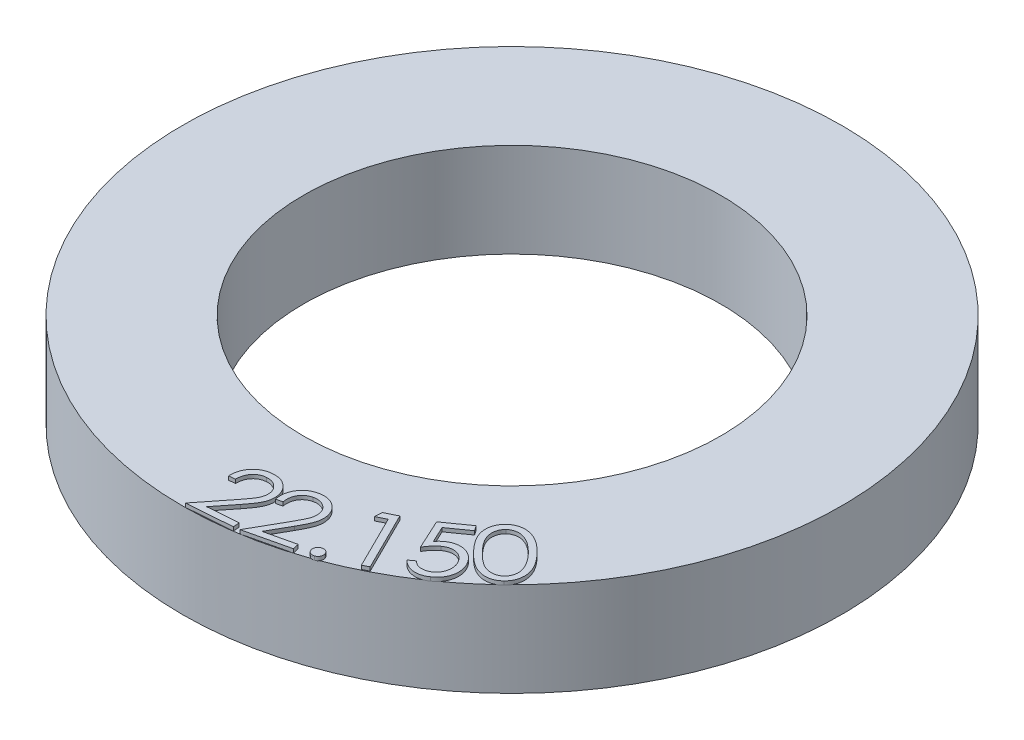
from build123d import *

# Parameters (mm, degrees)
SKETCH1_R           = 17.5
SKETCH1_R_2         = 11.075
BOSS_EXTRUDE1_DEPTH = 5
BOSS_EXTRUDE8_DEPTH = 0.2


with BuildPart() as part:
    # Sketch1 → Boss-Extrude1 (new body)
    with BuildSketch(Plane(origin=(0, 0, 0), x_dir=(1, 0, 0), z_dir=(0, 1, 0))):
        Circle(SKETCH1_R)
        Circle(SKETCH1_R_2, mode=Mode.SUBTRACT)
    extrude(amount=BOSS_EXTRUDE1_DEPTH)

    # Sketch8 → Boss-Extrude8 (add)
    # profile 1 of 6: a face of its own
    with BuildSketch(Plane(origin=(0, 5, 0), x_dir=(1, 0, 0), z_dir=(0, 1, 0))):
        with BuildLine():
            Line((0.377203526, -15.06640625), (0.043469551, -15.092347756))
            add(Edge.make_bspline(
                [(0.043469551, -15.092347756), (0.042203297, -15.050032699), (0.039723419, -14.96716131), (0.049638285, -14.844981972), (0.067688405, -14.727624407), (0.098455755, -14.61556583), (0.138504263, -14.508522308), (0.188279293, -14.405930448), (0.249943807, -14.309195828), (0.320224245, -14.217586795), (0.399116148, -14.133937543), (0.484222111, -14.059456033), (0.574336923, -13.993992114), (0.671078969, -13.940092371), (0.773224869, -13.895612995), (0.881084602, -13.861423192), (0.994390789, -13.836174987), (1.072362547, -13.828578994), (1.111979167, -13.824719551)],
                knots=[0, 0, 0, 0, 1.099165856, 2.152647473, 3.179901334, 4.180092559, 5.165857059, 6.14623908, 7.136854445, 8.141313093, 9.142222958, 10.119044223, 11.076246807, 12.030555843, 12.990566437, 13.966122304, 14.966608418, 16, 16, 16, 16], degree=3))
            add(Edge.make_bspline(
                [(1.111979167, -13.824719551), (1.151232363, -13.822614291), (1.227892409, -13.818502795), (1.341072803, -13.824300473), (1.449209712, -13.840047194), (1.552456645, -13.867170925), (1.650809554, -13.903432336), (1.744251767, -13.950064736), (1.832189716, -14.007297288), (1.914237577, -14.07371881), (1.989801801, -14.146775331), (2.056191283, -14.225750107), (2.115236363, -14.307662186), (2.163673815, -14.394967734), (2.203994369, -14.485852699), (2.23381166, -14.581483532), (2.256306856, -14.680631266), (2.263224051, -14.74868976), (2.266726763, -14.783153045)],
                knots=[0, 0, 0, 0, 1.125255338, 2.197582177, 3.23984224, 4.249678898, 5.249348258, 6.237204937, 7.234226399, 8.248247252, 9.256507582, 10.239567543, 11.199778339, 12.143800945, 13.093950023, 14.042329097, 15.008679649, 16, 16, 16, 16], degree=3))
            add(Edge.make_bspline(
                [(2.266726763, -14.783153045), (2.268653871, -14.83201524), (2.272472697, -14.928842275), (2.256591946, -15.073272294), (2.221554197, -15.213909987), (2.177756368, -15.329043673), (2.13210079, -15.422970742), (2.088829613, -15.499650514), (2.039151976, -15.583479859), (1.980752569, -15.67318269), (1.913642882, -15.76882397), (1.840613729, -15.872212721), (1.757921696, -15.980725817), (1.700055339, -16.055042687), (1.670072115, -16.093549679)],
                knots=[0, 0, 0, 0, 1.190284496, 2.358709392, 3.525773572, 4.713480732, 5.352743619, 6.06901355, 6.858115264, 7.726847504, 8.676217017, 9.704931629, 10.810819393, 12, 12, 12, 12], degree=3))
            Line((1.670072115, -16.093549679), (0.875701122, -17.094751603))
            Line((0.875701122, -17.094751603), (2.482672276, -16.971354167))
            Line((2.482672276, -16.971354167), (2.508613782, -17.307191506))
            Line((2.508613782, -17.307191506), (0.14443109, -17.488782051))
            Line((0.14443109, -17.488782051), (1.363681891, -15.949819712))
            add(Edge.make_bspline(
                [(1.363681891, -15.949819712), (1.393527022, -15.912554926), (1.450782044, -15.841066007), (1.530584566, -15.73612355), (1.602999147, -15.639675593), (1.666852925, -15.550639363), (1.722438282, -15.469396851), (1.76961629, -15.395481899), (1.809021619, -15.329602995), (1.849329165, -15.251857602), (1.888211722, -15.159145837), (1.917541309, -15.046099013), (1.933704742, -14.93175562), (1.93042781, -14.855174346), (1.928786058, -14.816806891)],
                knots=[0, 0, 0, 0, 1.323859622, 2.539697786, 3.655679983, 4.668207506, 5.577749991, 6.384956845, 7.099630202, 7.705429782, 8.812646299, 9.878423536, 10.93708365, 12, 12, 12, 12], degree=3))
            add(Edge.make_bspline(
                [(1.928786058, -14.816806891), (1.92620974, -14.792668697), (1.921140936, -14.745177743), (1.905685163, -14.675960851), (1.882668381, -14.610204079), (1.854314913, -14.54686504), (1.818130268, -14.487171166), (1.775716227, -14.430480301), (1.726271651, -14.377301953), (1.671340099, -14.327125852), (1.611934069, -14.281949704), (1.548780398, -14.24375581), (1.483443961, -14.212316408), (1.415907726, -14.186368957), (1.345139571, -14.169292508), (1.271999298, -14.157876025), (1.196114655, -14.153502913), (1.144924611, -14.156323447), (1.118990385, -14.157752404)],
                knots=[0, 0, 0, 0, 1.002985613, 1.973335034, 2.923515741, 3.878986154, 4.836651989, 5.802759845, 6.800988188, 7.833639541, 8.87511098, 9.880838076, 10.878972912, 11.86950441, 12.865345595, 13.881918786, 14.926924211, 16, 16, 16, 16], degree=3))
            add(Edge.make_bspline(
                [(1.118990385, -14.157752404), (1.091811261, -14.160540619), (1.038491161, -14.166010548), (0.960749235, -14.182373159), (0.886899306, -14.205342141), (0.817246391, -14.235736869), (0.751710741, -14.272344942), (0.690146343, -14.315288584), (0.633132276, -14.365692478), (0.580060436, -14.422065975), (0.532383632, -14.484564259), (0.490634628, -14.552362028), (0.455698611, -14.625546395), (0.426899376, -14.703718722), (0.404472482, -14.787020099), (0.388336351, -14.875402791), (0.379467781, -14.969236984), (0.377971809, -15.033435801), (0.377203526, -15.06640625)],
                knots=[0, 0, 0, 0, 1.003856858, 1.969369873, 2.914991585, 3.842326504, 4.757764574, 5.67065914, 6.596081697, 7.550367434, 8.512664105, 9.480773, 10.472199548, 11.488843046, 12.539268398, 13.639696742, 14.787824085, 16, 16, 16, 16], degree=3))
        make_face()
    # profile 2 of 6: a face of its own
    with BuildSketch(Plane(origin=(0, 5, 0), x_dir=(1, 0, 0), z_dir=(0, 1, 0))):
        with BuildLine():
            Line((2.680077799, -14.84254585), (2.355458408, -14.918267004))
            add(Edge.make_bspline(
                [(2.355458408, -14.918267004), (2.347994142, -14.876767046), (2.333387531, -14.795556953), (2.323472579, -14.673990721), (2.324976016, -14.555728299), (2.336513827, -14.440605451), (2.359783356, -14.328975701), (2.394590343, -14.221092867), (2.439601661, -14.116379831), (2.494569659, -14.015576781), (2.559832485, -13.921863348), (2.631188548, -13.834656401), (2.710921768, -13.757361702), (2.797573287, -13.688946733), (2.891342116, -13.629703088), (2.992353062, -13.580084855), (3.099856127, -13.537971321), (3.175300136, -13.518303724), (3.213631485, -13.508311075)],
                knots=[0, 0, 0, 0, 1.100238416, 2.153025381, 3.178012026, 4.183884262, 5.168591255, 6.148695239, 7.138002634, 8.140019377, 9.140121407, 10.114951831, 11.077023251, 12.032670763, 12.99234068, 13.966349905, 14.966749606, 16, 16, 16, 16], degree=3))
            add(Edge.make_bspline(
                [(3.213631485, -13.508311075), (3.251843088, -13.50036415), (3.32664053, -13.484808413), (3.438897548, -13.473770246), (3.547813259, -13.472847982), (3.653615731, -13.482442125), (3.755983303, -13.503477882), (3.854414489, -13.536291351), (3.950096274, -13.578421826), (4.040814221, -13.631584861), (4.126003653, -13.692404589), (4.204208412, -13.758970295), (4.274030899, -13.831494589), (4.335160407, -13.90960072), (4.388361962, -13.993145467), (4.432982751, -14.082231672), (4.470178835, -14.176708828), (4.487307474, -14.242643219), (4.495983248, -14.27603944)],
                knots=[0, 0, 0, 0, 1.121990491, 2.196244399, 3.238232453, 4.250969426, 5.246356061, 6.236987075, 7.230101134, 8.248200839, 9.255501669, 10.237657177, 11.19803806, 12.146105858, 13.086011545, 14.042029985, 15.008274769, 16, 16, 16, 16], degree=3))
            add(Edge.make_bspline(
                [(4.495983248, -14.27603944), (4.505415824, -14.323774993), (4.524110077, -14.41838123), (4.529985585, -14.56283772), (4.516844757, -14.706380405), (4.49162199, -14.826395359), (4.460506924, -14.925374116), (4.431085731, -15.007919873), (4.393488718, -15.097141834), (4.349829317, -15.194418504), (4.299347185, -15.299042154), (4.242538162, -15.411720311), (4.177915647, -15.531101044), (4.131979942, -15.612908193), (4.108262895, -15.655146011)],
                knots=[0, 0, 0, 0, 1.190223456, 2.358882579, 3.52524119, 4.712819824, 5.35365978, 6.065105631, 6.857984567, 7.723828008, 8.67607557, 9.702436758, 10.813745988, 12, 12, 12, 12], degree=3))
            Line((4.108262895, -15.655146011), (3.479356645, -16.761516203))
            Line((3.479356645, -16.761516203), (5.041456004, -16.394829504))
            Line((5.041456004, -16.394829504), (5.11787828, -16.721552261))
            Line((5.11787828, -16.721552261), (2.819601036, -17.260714921))
            Line((2.819601036, -17.260714921), (3.785045748, -15.56119569))
            add(Edge.make_bspline(
                [(3.785045748, -15.56119569), (3.808529371, -15.519892567), (3.8536226, -15.440582352), (3.91665988, -15.325551236), (3.973290102, -15.219474376), (4.021957514, -15.121779814), (4.064311127, -15.032979861), (4.100364837, -14.953571722), (4.128654637, -14.882434307), (4.156784414, -14.800101176), (4.179688984, -14.702577351), (4.192972915, -14.587024863), (4.189968714, -14.471889792), (4.175230987, -14.396958355), (4.167858248, -14.359472934)],
                knots=[0, 0, 0, 0, 1.322508168, 2.539478858, 3.65113322, 4.669382137, 5.577246142, 6.389686428, 7.096378664, 7.707362647, 8.810322298, 9.877140803, 10.938012216, 12, 12, 12, 12], degree=3))
            add(Edge.make_bspline(
                [(4.167858248, -14.359472934), (4.161829404, -14.336171476), (4.149935411, -14.290201239), (4.123387221, -14.224893717), (4.091995869, -14.16328915), (4.053584185, -14.106135055), (4.009399893, -14.052600205), (3.95860095, -14.003544562), (3.901957352, -13.958350343), (3.840235373, -13.917568468), (3.775029978, -13.881814057), (3.707248163, -13.853637752), (3.637912338, -13.832678602), (3.56741324, -13.817301491), (3.494890393, -13.811664684), (3.421495235, -13.811468351), (3.346244991, -13.818247864), (3.296509601, -13.82889709), (3.271123472, -13.834332709)],
                knots=[0, 0, 0, 0, 0.998805992, 1.97049261, 2.921394182, 3.866479787, 4.824835265, 5.799717433, 6.794315519, 7.830951375, 8.869177059, 9.878822869, 10.873799922, 11.875291578, 12.869368348, 13.888722291, 14.922353531, 16, 16, 16, 16], degree=3))
            add(Edge.make_bspline(
                [(3.271123472, -13.834332709), (3.244792519, -13.841064204), (3.193002937, -13.854304184), (3.119061623, -13.882705923), (3.050115946, -13.91714881), (2.986034959, -13.957311139), (2.926579811, -14.002814596), (2.87305675, -14.05555418), (2.823928987, -14.113545846), (2.780414933, -14.177443519), (2.743380272, -14.246402199), (2.712244756, -14.319205359), (2.689061885, -14.396615139), (2.673136557, -14.477873433), (2.664009273, -14.563501926), (2.662180891, -14.653056839), (2.666949138, -14.746824786), (2.675629023, -14.810109822), (2.680077799, -14.84254585)],
                knots=[0, 0, 0, 0, 1.001857296, 1.97052376, 2.915105733, 3.840812044, 4.756468097, 5.670946457, 6.606992161, 7.556283339, 8.516782409, 9.490308786, 10.47212129, 11.491627338, 12.540773751, 13.644567144, 14.792749573, 16, 16, 16, 16], degree=3))
        make_face()
    # profile 3 of 6: a face of its own
    with BuildSketch(Plane(origin=(0, 5, 0), x_dir=(1, 0, 0), z_dir=(0, 1, 0))):
        with BuildLine():
            add(Edge.make_bspline(
                [(5.812610444, -15.938128556), (5.831374417, -15.932374898), (5.868100028, -15.921113607), (5.925587729, -15.918820778), (5.982023209, -15.927326543), (6.036365652, -15.947186897), (6.086750753, -15.976062519), (6.129683552, -16.014781695), (6.164195697, -16.061839206), (6.179302393, -16.097844445), (6.187009483, -16.116213491)],
                knots=[0, 0, 0, 0, 1.018533362, 1.993514881, 2.966138152, 3.9748784, 4.989476654, 5.972026843, 6.965374611, 8, 8, 8, 8], degree=3))
            add(Edge.make_bspline(
                [(6.187009483, -16.116213491), (6.192680674, -16.134982532), (6.203852009, -16.171954526), (6.207259114, -16.229869607), (6.198423544, -16.286997519), (6.178873974, -16.341926891), (6.149719297, -16.392227049), (6.111823907, -16.435344643), (6.065578658, -16.469979456), (6.029886494, -16.484584723), (6.011729034, -16.492014773)],
                knots=[0, 0, 0, 0, 1.018247088, 2.005783202, 2.990165439, 4.010083513, 5.024396598, 5.998572224, 6.981825626, 8, 8, 8, 8], degree=3))
            add(Edge.make_bspline(
                [(6.011729034, -16.492014773), (5.992964701, -16.497770106), (5.956238387, -16.509034678), (5.898755786, -16.511303732), (5.842003107, -16.502843983), (5.787364663, -16.482393394), (5.737095106, -16.452595757), (5.694096527, -16.414271405), (5.660232144, -16.367416245), (5.645083379, -16.332037335), (5.637329996, -16.313929838)],
                knots=[0, 0, 0, 0, 1.019327242, 1.995068695, 2.968450063, 3.99358383, 5.015165017, 5.99848104, 6.975590248, 8, 8, 8, 8], degree=3))
            add(Edge.make_bspline(
                [(5.637329996, -16.313929838), (5.63125142, -16.294941947), (5.619366426, -16.257816312), (5.617673921, -16.1996281), (5.624612676, -16.142442807), (5.645777227, -16.087974496), (5.675371175, -16.038150206), (5.712952105, -15.994657098), (5.759716127, -15.961248414), (5.794765915, -15.945928316), (5.812610444, -15.938128556)],
                knots=[0, 0, 0, 0, 1.033330105, 2.02039479, 3.003248301, 4.016090021, 5.036799157, 6.01117572, 6.98745084, 8, 8, 8, 8], degree=3))
        make_face()
    # profile 4 of 6: a face of its own
    with BuildSketch(Plane(origin=(0, 5, 0), x_dir=(1, 0, 0), z_dir=(0, 1, 0))):
        Polygon((5.818273577, -12.696277718), (6.43245627, -12.391289737), (7.984038802, -15.51759182), (7.673441847, -15.671838615), (6.274002744, -12.851926756), (5.783217488, -13.095216019), align=None)
    # profile 5 of 6: a face of its own
    with BuildSketch(Plane(origin=(0, 5, 0), x_dir=(1, 0, 0), z_dir=(0, 1, 0))):
        with BuildLine():
            Line((8.905820544, -10.81501346), (9.096525672, -11.084945351))
            Line((9.096525672, -11.084945351), (8.086209166, -11.800089582))
            Line((8.086209166, -11.800089582), (8.492859807, -12.672285095))
            add(Edge.make_bspline(
                [(8.492859807, -12.672285095), (8.51705623, -12.642776), (8.563899554, -12.58564755), (8.637538854, -12.507497305), (8.711727906, -12.439832324), (8.763205185, -12.400830704), (8.788032083, -12.382020672)],
                knots=[0, 0, 0, 0, 1.102510947, 2.134417912, 3.100251258, 4, 4, 4, 4], degree=3))
            add(Edge.make_bspline(
                [(8.788032083, -12.382020672), (8.820109592, -12.360315139), (8.883205401, -12.317620797), (8.983169841, -12.26619245), (9.084104752, -12.224617519), (9.186966618, -12.195460631), (9.291137291, -12.175799501), (9.397000003, -12.169368235), (9.504117602, -12.17260687), (9.611627853, -12.187634211), (9.717726072, -12.212338375), (9.819983806, -12.248599798), (9.917768605, -12.294202417), (10.010991446, -12.349865714), (10.099073358, -12.41645699), (10.182463758, -12.493131992), (10.261523131, -12.579753693), (10.309056949, -12.643349646), (10.333304519, -12.675790704)],
                knots=[0, 0, 0, 0, 1.053566777, 2.072344485, 3.054154547, 4.020735706, 4.977911009, 5.934388254, 6.901994919, 7.890871114, 8.884708514, 9.862655974, 10.838946315, 11.817700602, 12.812779523, 13.839512687, 14.897909552, 16, 16, 16, 16], degree=3))
            add(Edge.make_bspline(
                [(10.333304519, -12.675790704), (10.349205912, -12.699235475), (10.380632976, -12.745571055), (10.423192032, -12.817357695), (10.459224738, -12.891028059), (10.491272613, -12.965765182), (10.517783682, -13.042191306), (10.539530664, -13.120165711), (10.556617195, -13.199483347), (10.567516839, -13.279906402), (10.573828031, -13.360199115), (10.575483147, -13.439359499), (10.571252868, -13.517165799), (10.561309826, -13.593496762), (10.546565491, -13.668675023), (10.527043258, -13.742588506), (10.501668394, -13.814991678), (10.470823211, -13.885694753), (10.434827501, -13.954330198), (10.394959037, -14.021481751), (10.349312851, -14.085808807), (10.298517314, -14.147707169), (10.243212212, -14.207138609), (10.183172699, -14.264412663), (10.117967443, -14.319086296), (10.07151531, -14.353130068), (10.047947948, -14.370402082)],
                knots=[0, 0, 0, 0, 1.058904501, 2.092788817, 3.116471482, 4.122554999, 5.131063365, 6.137943179, 7.147208115, 8.161602767, 9.169391864, 10.156790113, 11.119252309, 12.079372117, 13.032029688, 13.98143675, 14.934695052, 15.8971969, 16.862391289, 17.830310157, 18.8144563, 19.807827508, 20.821657655, 21.847463179, 22.90791634, 24, 24, 24, 24], degree=3))
            add(Edge.make_bspline(
                [(10.047947948, -14.370402082), (10.019295417, -14.389862779), (9.9629447, -14.428135985), (9.874220463, -14.475514725), (9.784619171, -14.514890612), (9.693300776, -14.543872575), (9.600833617, -14.565819682), (9.506736536, -14.576358654), (9.411483019, -14.579568571), (9.315757613, -14.572902652), (9.220893158, -14.558560064), (9.128752094, -14.535160072), (9.039718529, -14.504233334), (8.953938577, -14.464936554), (8.871663046, -14.416729616), (8.792363016, -14.361250194), (8.715925142, -14.298110264), (8.669349113, -14.25026174), (8.645704358, -14.225970992)],
                knots=[0, 0, 0, 0, 1.073683973, 2.111606131, 3.114875596, 4.105229039, 5.079452871, 6.057740752, 7.036807216, 8.032083212, 9.029653356, 10.008961322, 10.976446223, 11.949563641, 12.930560464, 13.930051518, 14.949171403, 16, 16, 16, 16], degree=3))
            Line((8.645704358, -14.225970992), (8.937371025, -14.019140063))
            add(Edge.make_bspline(
                [(8.937371025, -14.019140063), (8.961635196, -14.041499254), (9.008383198, -14.084577071), (9.084201285, -14.136832231), (9.158803392, -14.179407726), (9.235041453, -14.209553815), (9.313100915, -14.227387514), (9.393294113, -14.236939881), (9.476366447, -14.235735942), (9.561361266, -14.22584273), (9.646348642, -14.207698302), (9.727651661, -14.178066609), (9.806271974, -14.142161027), (9.854122513, -14.110262042), (9.878276474, -14.094160095)],
                knots=[0, 0, 0, 0, 1.151762453, 2.219016371, 3.209870592, 4.148730593, 5.071934365, 6.000972824, 6.96479679, 7.967796459, 8.988367636, 9.993261107, 10.987039746, 12, 12, 12, 12], degree=3))
            add(Edge.make_bspline(
                [(9.878276474, -14.094160095), (9.900886283, -14.077356933), (9.945405903, -14.044270835), (10.004473384, -13.986657554), (10.056761909, -13.924757469), (10.101869674, -13.857739049), (10.139855962, -13.785798618), (10.170813452, -13.70926527), (10.193994743, -13.627662559), (10.20968222, -13.542453), (10.218603156, -13.455173936), (10.217315446, -13.367835639), (10.20950095, -13.281560177), (10.191643449, -13.196474173), (10.164432518, -13.112986445), (10.130312958, -13.029818023), (10.086624929, -12.948209386), (10.051682837, -12.896353989), (10.033925512, -12.870001441)],
                knots=[0, 0, 0, 0, 0.982901861, 1.935373165, 2.873857243, 3.808820726, 4.750847603, 5.710288131, 6.686831843, 7.708192972, 8.733167937, 9.745322852, 10.754049183, 11.754552243, 12.77418333, 13.817071584, 14.890651141, 16, 16, 16, 16], degree=3))
            add(Edge.make_bspline(
                [(10.033925512, -12.870001441), (10.016739606, -12.847064194), (9.983082244, -12.802143243), (9.927637085, -12.740434092), (9.86765414, -12.687621005), (9.80579606, -12.640216037), (9.739646488, -12.601869214), (9.670297945, -12.570688083), (9.597665974, -12.546894842), (9.522347996, -12.5298286), (9.445441033, -12.521871147), (9.368323581, -12.520522825), (9.291542529, -12.52961606), (9.214665448, -12.545586206), (9.137880173, -12.5704209), (9.061599494, -12.60370084), (8.984937331, -12.64432096), (8.936360282, -12.677627418), (8.911429519, -12.694720992)],
                knots=[0, 0, 0, 0, 1.074776657, 2.104872872, 3.104341879, 4.068556333, 5.023200681, 5.964838422, 6.915611592, 7.885388104, 8.855323063, 9.81081214, 10.772033681, 11.748521529, 12.752018427, 13.792504925, 14.867067091, 16, 16, 16, 16], degree=3))
            add(Edge.make_bspline(
                [(8.911429519, -12.694720992), (8.890466825, -12.710638616), (8.8473348, -12.7433901), (8.783963328, -12.798012343), (8.722079492, -12.860916409), (8.659124859, -12.929738637), (8.597107702, -13.006394604), (8.534604702, -13.08968846), (8.472995615, -13.18061774), (8.432856237, -13.24405509), (8.412230801, -13.276652082)],
                knots=[0, 0, 0, 0, 0.818651868, 1.684426275, 2.599403717, 3.561756698, 4.584719662, 5.664970434, 6.800155744, 8, 8, 8, 8], degree=3))
            Line((8.412230801, -13.276652082), (7.678156281, -11.683703364))
            Line((7.678156281, -11.683703364), (8.905820544, -10.81501346))
        make_face()
    # profile 6 of 6: a face of its own
    with BuildSketch(Plane(origin=(0, 5, 0), x_dir=(1, 0, 0), z_dir=(0, 1, 0))):
        with BuildLine():
            add(Edge.make_bspline(
                [(10.061528562, -12.10955222), (10.022956902, -12.068877282), (9.948043998, -11.989879446), (9.843004253, -11.871191764), (9.746856726, -11.757152028), (9.662558794, -11.645801129), (9.587265593, -11.538869256), (9.523014434, -11.435213056), (9.467760847, -11.335853691), (9.423120937, -11.239404772), (9.387161115, -11.145589547), (9.358439609, -11.053481538), (9.335685504, -10.96320001), (9.320265408, -10.874124207), (9.310912512, -10.786766665), (9.308712669, -10.700467974), (9.313761542, -10.61585785), (9.324855221, -10.532846238), (9.342571358, -10.452301381), (9.365447521, -10.37404815), (9.395206402, -10.299293261), (9.429624987, -10.226848525), (9.470387016, -10.157948288), (9.51591285, -10.091366706), (9.568349735, -10.028763459), (9.606703214, -9.989578446), (9.626131928, -9.969728502)],
                knots=[0, 0, 0, 0, 1.643143098, 3.191270976, 4.645664262, 6.014553529, 7.284140096, 8.478046464, 9.588014013, 10.61488382, 11.590779053, 12.531207317, 13.441789177, 14.318091217, 15.179101305, 16.015191765, 16.845564482, 17.661395641, 18.467677819, 19.261049258, 20.048571613, 20.823839802, 21.609930406, 22.392909899, 23.185896688, 24, 24, 24, 24], degree=3))
            add(Edge.make_bspline(
                [(9.626131928, -9.969728502), (9.646645091, -9.95069727), (9.687318886, -9.912961868), (9.752951978, -9.86262558), (9.82097751, -9.817156486), (9.892700351, -9.779015734), (9.966623737, -9.745702257), (10.043514762, -9.718255129), (10.123183777, -9.696568041), (10.20571016, -9.68103803), (10.290338148, -9.672191802), (10.376851129, -9.668875627), (10.464943764, -9.674490451), (10.554730722, -9.68541183), (10.646285721, -9.703999117), (10.739509478, -9.729242319), (10.834274843, -9.761744286), (10.930937146, -9.801087051), (11.029460742, -9.849217028), (11.13026139, -9.90588491), (11.233052994, -9.972445027), (11.338150651, -10.048209415), (11.4454711, -10.133940855), (11.554567784, -10.229792228), (11.66690382, -10.33373637), (11.740312315, -10.408325038), (11.777874716, -10.446491322)],
                knots=[0, 0, 0, 0, 0.814307392, 1.614620432, 2.405388273, 3.193927934, 3.97672154, 4.764468093, 5.568360162, 6.378448907, 7.206542137, 8.043948668, 8.895854568, 9.773619782, 10.675734413, 11.613311544, 12.583794371, 13.590896081, 14.649966002, 15.774206342, 16.955777189, 18.213503254, 19.545065278, 20.953335129, 22.441051684, 24, 24, 24, 24], degree=3))
            add(Edge.make_bspline(
                [(11.777874716, -10.446491322), (11.814854184, -10.485255248), (11.887044241, -10.560928863), (11.987574534, -10.675759496), (12.079295527, -10.787542626), (12.161694512, -10.896673681), (12.23353433, -11.004058588), (12.297534335, -11.10782118), (12.35070381, -11.20969791), (12.395436672, -11.308899574), (12.430866619, -11.406229864), (12.460879856, -11.501034296), (12.483379386, -11.594506766), (12.498899769, -11.686339274), (12.507460043, -11.776558786), (12.508968567, -11.865183233), (12.503213493, -11.952124966), (12.491394927, -12.037228558), (12.473097417, -12.119669422), (12.449411404, -12.199534266), (12.418928204, -12.275666565), (12.384035539, -12.349408099), (12.342167974, -12.419239764), (12.296135004, -12.487072917), (12.243421183, -12.551026654), (12.204245084, -12.590356211), (12.184525357, -12.610153181)],
                knots=[0, 0, 0, 0, 1.560920867, 3.047176545, 4.445805626, 5.773746473, 7.029772118, 8.209369219, 9.324227381, 10.375918751, 11.377815375, 12.340623291, 13.272194005, 14.176790602, 15.052286813, 15.910448986, 16.756638747, 17.588735874, 18.411585632, 19.215188949, 20.013145761, 20.798980117, 21.589668162, 22.383020387, 23.186075276, 24, 24, 24, 24], degree=3))
            add(Edge.make_bspline(
                [(12.184525357, -12.610153181), (12.16424862, -12.628954402), (12.124046156, -12.666231375), (12.059224592, -12.715701109), (11.992305933, -12.76050639), (11.922365456, -12.798903796), (11.849611869, -12.831325824), (11.774360209, -12.858062908), (11.696280994, -12.878994313), (11.615756722, -12.894783135), (11.532904199, -12.902798821), (11.448531042, -12.905134253), (11.36269871, -12.900118518), (11.275611133, -12.887862414), (11.186983445, -12.869740367), (11.096865638, -12.844171226), (11.005431965, -12.811821524), (10.911644662, -12.773094239), (10.81603972, -12.725093808), (10.717752152, -12.667036278), (10.615902013, -12.59978748), (10.511364422, -12.521162265), (10.402950549, -12.433133181), (10.291585958, -12.334444112), (10.176237024, -12.226733802), (10.100490943, -12.149354631), (10.061528562, -12.10955222)],
                knots=[0, 0, 0, 0, 0.811064481, 1.60808856, 2.389888403, 3.172620267, 3.946285432, 4.725040954, 5.513640096, 6.316661342, 7.130129069, 7.953396753, 8.791500303, 9.649899588, 10.53226685, 11.444204777, 12.396439187, 13.377193406, 14.420034322, 15.532790691, 16.725465982, 17.999767269, 19.369752981, 20.822718841, 22.365665447, 24, 24, 24, 24], degree=3))
        make_face()
        with BuildLine():
            add(Edge.make_bspline(
                [(10.304116703, -11.884492124), (10.337578269, -11.918574154), (10.402540546, -11.984741), (10.500104054, -12.077699958), (10.593067011, -12.162957402), (10.682719911, -12.238661617), (10.768464434, -12.305349323), (10.849584809, -12.364159763), (10.927584923, -12.413096761), (11.001701443, -12.454772772), (11.07418007, -12.487466292), (11.144334876, -12.516073575), (11.213934525, -12.538566035), (11.282589858, -12.555420101), (11.350311854, -12.566903194), (11.41715019, -12.572295009), (11.483263045, -12.573321261), (11.568750426, -12.566641613), (11.670517579, -12.54720082), (11.783580906, -12.506905605), (11.886149609, -12.450915311), (11.943927533, -12.400472609), (11.972786575, -12.37527738)],
                knots=[0, 0, 0, 0, 1.473957898, 2.861541556, 4.158429599, 5.366384119, 6.48165494, 7.510449078, 8.456966946, 9.322163817, 10.132208232, 10.909042953, 11.659478826, 12.387214262, 13.089187375, 13.776821919, 14.454856839, 15.127538109, 16.420448759, 17.638738311, 18.820591935, 20, 20, 20, 20], degree=3))
            add(Edge.make_bspline(
                [(11.972786575, -12.37527738), (11.999096913, -12.347144569), (12.051476146, -12.291137113), (12.111356623, -12.191364249), (12.15518686, -12.081272391), (12.177418612, -11.982136745), (12.186980934, -11.898714603), (12.188238906, -11.833712734), (12.183968496, -11.767351683), (12.174006317, -11.699854924), (12.158528791, -11.630950783), (12.137058338, -11.560904501), (12.111550388, -11.488878351), (12.089791002, -11.44169194), (12.078655966, -11.417545008)],
                knots=[0, 0, 0, 0, 1.340944698, 2.669583919, 4.030928969, 5.461188359, 6.19962706, 6.958188698, 7.726289627, 8.517420774, 9.336470106, 10.187844869, 11.072657056, 12, 12, 12, 12], degree=3))
            add(Edge.make_bspline(
                [(12.078655966, -11.417545008), (12.063987821, -11.387250039), (12.034271656, -11.325875523), (11.983464173, -11.23492443), (11.925602706, -11.144183163), (11.862651218, -11.051783909), (11.792167981, -10.959745433), (11.716675467, -10.866265116), (11.634371449, -10.772887308), (11.576158741, -10.711789779), (11.546504524, -10.680666002)],
                knots=[0, 0, 0, 0, 0.884558049, 1.79202434, 2.736150632, 3.71244019, 4.72966929, 5.78206634, 6.87015931, 8, 8, 8, 8], degree=3))
            add(Edge.make_bspline(
                [(11.546504524, -10.680666002), (11.516301384, -10.650102624), (11.457161501, -10.590257369), (11.367546578, -10.505677176), (11.279867397, -10.427540032), (11.193607132, -10.35629109), (11.10797441, -10.292846712), (11.024755152, -10.235143983), (10.943159202, -10.184037211), (10.862523381, -10.140895389), (10.783992203, -10.103457249), (10.707158132, -10.072406083), (10.632416474, -10.047329921), (10.559769283, -10.027135588), (10.488709433, -10.013658365), (10.419504972, -10.006866602), (10.352163725, -10.004956096), (10.266745298, -10.012015905), (10.165243051, -10.030256677), (10.053220513, -10.071098865), (9.951222655, -10.125903849), (9.89428322, -10.176093731), (9.865915582, -10.201098694)],
                knots=[0, 0, 0, 0, 1.326591129, 2.597559181, 3.803812624, 4.952220953, 6.050454968, 7.093242857, 8.07839134, 9.021111463, 9.915189371, 10.763364664, 11.577972641, 12.348162485, 13.089731918, 13.807721709, 14.493365527, 15.166324271, 16.451327591, 17.663329693, 18.835853919, 20, 20, 20, 20], degree=3))
            add(Edge.make_bspline(
                [(9.865915582, -10.201098694), (9.839602185, -10.229223864), (9.787080212, -10.285362167), (9.727011752, -10.385763893), (9.684471656, -10.497426589), (9.661850945, -10.597731936), (9.65250305, -10.682110796), (9.65111291, -10.747808025), (9.655590871, -10.814344744), (9.664646974, -10.88234401), (9.679586891, -10.951369214), (9.699237993, -11.021928223), (9.724553286, -11.09336078), (9.755832937, -11.166465722), (9.794229351, -11.242469839), (9.841254557, -11.321957006), (9.897038472, -11.40550307), (9.961236995, -11.493358688), (10.033850008, -11.585802517), (10.116607022, -11.681586658), (10.206493435, -11.782641277), (10.270939053, -11.849877715), (10.304116703, -11.884492124)],
                knots=[0, 0, 0, 0, 1.185970551, 2.367216757, 3.582004018, 4.861034475, 5.528469342, 6.19936335, 6.885891938, 7.584587042, 8.314486342, 9.063449579, 9.843573315, 10.65137712, 11.515794273, 12.469475821, 13.499641158, 14.614767356, 15.826768159, 17.126133982, 18.52048713, 20, 20, 20, 20], degree=3))
        make_face(mode=Mode.SUBTRACT)
    extrude(amount=BOSS_EXTRUDE8_DEPTH)


solid = part.part
